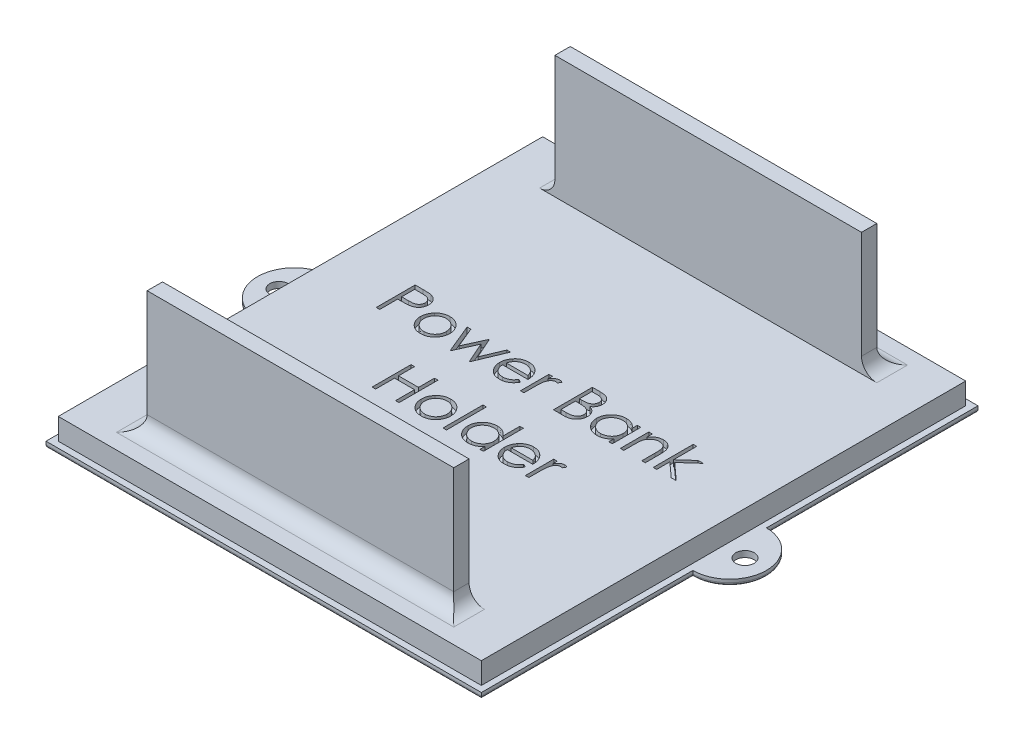
from build123d import *

# Parameters (mm, degrees)
SKETCH1_W            = 71
SKETCH1_H            = 81
BOSS_EXTRUDE1_DEPTH  = 4.5
BOSS_EXTRUDE3_DEPTH  = 4.5
SKETCH5_R            = 1.5
CUT_EXTRUDE2_DEPTH   = 4.5
SKETCH61_W           = 89
SKETCH61_H           = 99
SKETCH61_W_2         = 69
SKETCH61_H_2         = 79
CUT_EXTRUDE21_DEPTH  = 3.5
TEXT_2_W             = 0.569871795
TEXT_2_H             = 6.512820513
CUT_EXTRUDE1_DEPTH   = 1
SKETCH9_W            = 50
SKETCH9_H            = 2.5
TOP_TRACK_DEPTH      = 20
FILLET1_R            = 2.5
FILLET1_OF_MIRROR4_R = 2.5
FILLET2_R            = 0.5


with BuildPart() as part:
    # Sketch1 → Boss-Extrude1 (new body)
    with BuildSketch(Plane(origin=(0, 0, 0), x_dir=(1, 0, 0), z_dir=(0, 1, 0))):
        Rectangle(SKETCH1_W, SKETCH1_H)
    extrude(amount=BOSS_EXTRUDE1_DEPTH)

    # Sketch4 → Boss-Extrude3 (add)
    with BuildSketch(Plane(origin=(0, 4.5, 0), x_dir=(1, 0, 0), z_dir=(0, 1, 0))):
        with BuildLine():
            Line((-35.5, 6), (-35.5, -6))
            ThreePointArc((-35.5, -6), (-41.5, 0), (-35.5, 6))
        make_face()
    boss_extrude3 = extrude(amount=-BOSS_EXTRUDE3_DEPTH)

    # Sketch5 → Cut-Extrude2 (cut)
    with BuildSketch(Plane(origin=(0, 4.5, 0), x_dir=(1, 0, 0), z_dir=(0, 1, 0))):
        with Locations(Location((-38, 0, 0), (0, 0, 270))):
            Circle(SKETCH5_R)
    cut_extrude2 = extrude(amount=-CUT_EXTRUDE2_DEPTH, mode=Mode.SUBTRACT)

    # Mirror3: Boss-Extrude3, Cut-Extrude2 across plane
    add(boss_extrude3.mirror(Plane(origin=(0, 0, 0), x_dir=(0, 0, 1), z_dir=(1, 0, 0))))
    add(cut_extrude2.mirror(Plane(origin=(0, 0, 0), x_dir=(0, 0, 1), z_dir=(1, 0, 0))), mode=Mode.SUBTRACT)

    # Sketch61 → Cut-Extrude21 (cut)
    with BuildSketch(Plane(origin=(0, 4.5, 0), x_dir=(1, 0, 0), z_dir=(0, 1, 0))):
        Rectangle(SKETCH61_W, SKETCH61_H)
        Rectangle(SKETCH61_W_2, SKETCH61_H_2, mode=Mode.SUBTRACT)
    extrude(amount=-CUT_EXTRUDE21_DEPTH, mode=Mode.SUBTRACT)

    # text 2 → Cut-Extrude1 (cut)
    # profile 1 of 15: a face of its own
    with BuildSketch(Plane(origin=(0, 4.5, 0), x_dir=(1, 0, 0), z_dir=(0, 1, 0))):
        with BuildLine():
            Line((-23.961048132, 8.167718703), (-22.715725616, 8.167718703))
            add(Edge.make_bspline(
                [(-22.715725616, 8.167718703), (-22.630071544, 8.167624548), (-22.465954537, 8.167444144), (-22.230614364, 8.161974533), (-22.016873851, 8.154668963), (-21.825193874, 8.144541814), (-21.654984668, 8.132573715), (-21.507016424, 8.115787872), (-21.380126086, 8.098261336), (-21.304095814, 8.080442498), (-21.26942153, 8.072316058)],
                knots=[0, 0, 0, 0, 1.415646017, 2.712440637, 3.8905458, 4.950247383, 5.884950622, 6.709939814, 7.411656543, 8, 8, 8, 8], degree=3))
            add(Edge.make_bspline(
                [(-21.26942153, 8.072316058), (-21.225527547, 8.06030195), (-21.138773888, 8.036556829), (-21.01376771, 7.988997645), (-20.894834305, 7.932605717), (-20.78156562, 7.868336569), (-20.675353555, 7.793432759), (-20.574613452, 7.710930624), (-20.480234345, 7.61892535), (-20.392746963, 7.518448865), (-20.312401687, 7.411187913), (-20.243223548, 7.295541295), (-20.185298437, 7.173455645), (-20.135617358, 7.04501588), (-20.099860591, 6.909143436), (-20.072924073, 6.766782401), (-20.05582692, 6.617948034), (-20.054189415, 6.516239418), (-20.053355825, 6.464463494)],
                knots=[0, 0, 0, 0, 0.999701418, 1.975846123, 2.934577507, 3.890451536, 4.834027766, 5.787354733, 6.749476667, 7.726910423, 8.712836071, 9.690891519, 10.682875813, 11.679750201, 12.712814741, 13.765529915, 14.8625177, 16, 16, 16, 16], degree=3))
            add(Edge.make_bspline(
                [(-20.053355825, 6.464463494), (-20.054120409, 6.412252385), (-20.055616371, 6.310097823), (-20.07357106, 6.16065005), (-20.097755837, 6.0178324), (-20.134943346, 5.88196154), (-20.183649067, 5.753844356), (-20.240784649, 5.631522978), (-20.309697625, 5.51707843), (-20.388881816, 5.410095231), (-20.47696828, 5.310472962), (-20.573584325, 5.218933549), (-20.678339899, 5.136012821), (-20.790902082, 5.061524883), (-20.912368236, 4.997197062), (-21.040896143, 4.939580237), (-21.177602965, 4.891191313), (-21.272204383, 4.865736773), (-21.32030294, 4.852794825)],
                knots=[0, 0, 0, 0, 1.121902311, 2.195077645, 3.232258892, 4.234102512, 5.217864754, 6.176164875, 7.132989551, 8.084763148, 9.034132444, 9.988522005, 10.94243251, 11.903244335, 12.886203696, 13.894208494, 14.929344452, 16, 16, 16, 16], degree=3))
            add(Edge.make_bspline(
                [(-21.32030294, 4.852794825), (-21.360085389, 4.844334845), (-21.447270938, 4.825794307), (-21.590858449, 4.805096106), (-21.758036506, 4.787429317), (-21.948576928, 4.774182967), (-22.162308684, 4.762843013), (-22.399347394, 4.753829471), (-22.660158363, 4.748876736), (-22.842079048, 4.748621298), (-22.937059751, 4.748487933)],
                knots=[0, 0, 0, 0, 0.601384939, 1.31797006, 2.144135048, 3.087295005, 4.142315834, 5.309527816, 6.595305764, 8, 8, 8, 8], degree=3))
            Line((-22.937059751, 4.748487933), (-23.391176337, 4.748487933))
            Line((-23.391176337, 4.748487933), (-23.391176337, 1.817718703))
            Line((-23.391176337, 1.817718703), (-23.961048132, 1.817718703))
            Line((-23.961048132, 1.817718703), (-23.961048132, 8.167718703))
        make_face()
        with BuildLine():
            Line((-23.391176337, 7.516436651), (-23.391176337, 5.399769985))
            Line((-23.391176337, 5.399769985), (-22.279417523, 5.385777597))
            add(Edge.make_bspline(
                [(-22.279417523, 5.385777597), (-22.225134229, 5.385749542), (-22.120341449, 5.385695381), (-21.968964302, 5.392925715), (-21.828521737, 5.401272396), (-21.699445151, 5.413493286), (-21.581676355, 5.430767567), (-21.475018982, 5.448206006), (-21.380300054, 5.473434307), (-21.269448645, 5.507403304), (-21.145926, 5.565338192), (-21.011546305, 5.649430135), (-20.897662527, 5.75661942), (-20.799113617, 5.877138486), (-20.720907239, 6.01121262), (-20.663655653, 6.154666263), (-20.630016696, 6.306028218), (-20.62550603, 6.409602413), (-20.623227619, 6.461919424)],
                knots=[0, 0, 0, 0, 1.160613943, 2.240541288, 3.23993089, 4.169200891, 5.011653406, 5.7853311, 6.478053781, 7.106038997, 8.262395093, 9.384106736, 10.481365981, 11.59014053, 12.70357646, 13.786202915, 14.881775077, 16, 16, 16, 16], degree=3))
            add(Edge.make_bspline(
                [(-20.623227619, 6.461919424), (-20.625518421, 6.512970727), (-20.630072251, 6.614454399), (-20.663919317, 6.763187293), (-20.720795929, 6.905129214), (-20.799638608, 7.03752324), (-20.895326086, 7.157608642), (-21.006540609, 7.261924858), (-21.133020383, 7.345784233), (-21.250673602, 7.399910329), (-21.355178611, 7.432958043), (-21.445950881, 7.456080825), (-21.548441105, 7.474542283), (-21.662682648, 7.489491095), (-21.787790046, 7.502288089), (-21.924838132, 7.510971219), (-22.073307742, 7.516053861), (-22.176378349, 7.516305965), (-22.229808148, 7.516436651)],
                knots=[0, 0, 0, 0, 1.120700087, 2.227813068, 3.331159281, 4.466773991, 5.599788987, 6.693661531, 7.80175334, 8.91857717, 9.525282508, 10.207424825, 10.974604443, 11.810962634, 12.737642355, 13.736264703, 14.826523623, 16, 16, 16, 16], degree=3))
            Line((-22.229808148, 7.516436651), (-23.391176337, 7.516436651))
        make_face(mode=Mode.SUBTRACT)
    # profile 2 of 15: a face of its own
    with BuildSketch(Plane(origin=(0, 4.5, 0), x_dir=(1, 0, 0), z_dir=(0, 1, 0))):
        with BuildLine():
            add(Edge.make_bspline(
                [(-16.672286113, 6.539513575), (-16.585216232, 6.537659572), (-16.414493475, 6.534024326), (-16.164470596, 6.49517146), (-15.925810135, 6.435758385), (-15.697598044, 6.353622836), (-15.482757051, 6.24352844), (-15.278157794, 6.112157298), (-15.08436122, 5.956523164), (-14.968205153, 5.836130668), (-14.909245248, 5.775020385)],
                knots=[0, 0, 0, 0, 1.054011418, 2.066658804, 3.057071809, 4.030435133, 4.997543892, 5.974964718, 6.972108034, 8, 8, 8, 8], degree=3))
            add(Edge.make_bspline(
                [(-14.909245248, 5.775020385), (-14.858477988, 5.716575011), (-14.757925955, 5.600815342), (-14.628992437, 5.413117301), (-14.517919035, 5.218734547), (-14.428904806, 5.015085826), (-14.35871912, 4.803948923), (-14.3088885, 4.584598131), (-14.279248632, 4.357517872), (-14.275251821, 4.203296623), (-14.273227619, 4.125190658)],
                knots=[0, 0, 0, 0, 1.025258237, 2.030674902, 3.01204498, 3.988269485, 4.97094183, 5.956517959, 6.965070386, 8, 8, 8, 8], degree=3))
            add(Edge.make_bspline(
                [(-14.273227619, 4.125190658), (-14.275008046, 4.046631982), (-14.278526251, 3.891396374), (-14.311806812, 3.662761239), (-14.363570354, 3.441064918), (-14.437650974, 3.227235574), (-14.532643544, 3.020619587), (-14.648559506, 2.822119404), (-14.786212297, 2.631343391), (-14.94224812, 2.449911485), (-15.114699381, 2.282695638), (-15.301781535, 2.136957206), (-15.49981814, 2.012095297), (-15.711442509, 1.911517801), (-15.934722092, 1.832215916), (-16.170138487, 1.776517314), (-16.417325972, 1.742841117), (-16.586103931, 1.738516634), (-16.672286113, 1.736308446)],
                knots=[0, 0, 0, 0, 0.998656419, 1.973391657, 2.932242238, 3.890759089, 4.846373663, 5.82037756, 6.809684879, 7.83454468, 8.860553229, 9.859544525, 10.845671541, 11.83227036, 12.833544569, 13.85385346, 14.904124723, 16, 16, 16, 16], degree=3))
            add(Edge.make_bspline(
                [(-16.672286113, 1.736308446), (-16.758890533, 1.738524045), (-16.928509664, 1.742863407), (-17.17656966, 1.776386478), (-17.412407968, 1.832190246), (-17.635979854, 1.911778411), (-17.848514077, 2.012098512), (-18.04769815, 2.13657972), (-18.234932282, 2.282738859), (-18.407420025, 2.449899773), (-18.563446066, 2.631346409), (-18.701101381, 2.822118621), (-18.817016687, 3.020619791), (-18.912009429, 3.227235519), (-18.986090004, 3.441064933), (-19.037853558, 3.662761235), (-19.071134115, 3.891396375), (-19.074652321, 4.046631982), (-19.076432748, 4.125190658)],
                knots=[0, 0, 0, 0, 1.099876186, 2.154163076, 3.173186993, 4.173200201, 5.163417411, 6.152872554, 7.150605724, 8.17532212, 9.198891216, 10.186952605, 11.159729845, 12.11414092, 13.071450619, 14.029093627, 15.002601286, 16, 16, 16, 16], degree=3))
            add(Edge.make_bspline(
                [(-19.076432748, 4.125190658), (-19.074394742, 4.202872105), (-19.07035984, 4.356668021), (-19.040749774, 4.583321403), (-18.991113536, 4.802300951), (-18.920843716, 5.012622886), (-18.831009013, 5.215379178), (-18.72149639, 5.410242228), (-18.591247671, 5.597091523), (-18.491095559, 5.712701583), (-18.440415119, 5.77120428)],
                knots=[0, 0, 0, 0, 1.031353054, 2.041901799, 3.029428768, 4.008703097, 4.981709435, 5.96992636, 6.972712378, 8, 8, 8, 8], degree=3))
            add(Edge.make_bspline(
                [(-18.440415119, 5.77120428), (-18.381544104, 5.832844527), (-18.265763894, 5.954070918), (-18.071002631, 6.109251355), (-17.866906698, 6.243356232), (-17.649691475, 6.35126308), (-17.421666862, 6.436241533), (-17.181783379, 6.495324682), (-16.930912086, 6.53388434), (-16.759353917, 6.537618463), (-16.672286113, 6.539513575)],
                knots=[0, 0, 0, 0, 1.027980169, 2.021703884, 2.998553061, 3.971491411, 4.943284454, 5.930300938, 6.949603206, 8, 8, 8, 8], degree=3))
        make_face()
        with BuildLine():
            add(Edge.make_bspline(
                [(-16.674830184, 5.96964178), (-16.736402707, 5.967891735), (-16.857958269, 5.964436822), (-17.036882373, 5.938158881), (-17.209130938, 5.896525552), (-17.375030755, 5.837372478), (-17.534022368, 5.760993047), (-17.686257998, 5.667179308), (-17.832185424, 5.557173802), (-17.968950025, 5.431148669), (-18.094466506, 5.293482493), (-18.204190835, 5.14680047), (-18.297490671, 4.993481814), (-18.375214959, 4.833367088), (-18.433103714, 4.664833708), (-18.475146198, 4.489790277), (-18.501399349, 4.307880164), (-18.504821778, 4.184216603), (-18.506560953, 4.121374552)],
                knots=[0, 0, 0, 0, 1.021534396, 2.016698045, 2.994645724, 3.958388632, 4.93408049, 5.916473867, 6.921342795, 7.962252576, 8.998418191, 10.008913653, 10.997312074, 11.973003931, 12.956656626, 13.948281152, 14.957379055, 16, 16, 16, 16], degree=3))
            add(Edge.make_bspline(
                [(-18.506560953, 4.121374552), (-18.503645716, 4.040181589), (-18.497859515, 3.879028739), (-18.450805586, 3.641699987), (-18.372090478, 3.413858627), (-18.265796414, 3.196840327), (-18.13261656, 2.996049194), (-17.97570431, 2.817030929), (-17.796743711, 2.662479529), (-17.597868061, 2.53424428), (-17.383139512, 2.432354438), (-17.155888758, 2.360147725), (-16.918869213, 2.313209083), (-16.756888458, 2.308543693), (-16.674830184, 2.306180241)],
                knots=[0, 0, 0, 0, 1.016792936, 2.018143844, 3.017858371, 4.030088057, 5.03801393, 6.028138512, 7.003788237, 7.991172063, 8.984598303, 9.972568034, 10.972917682, 12, 12, 12, 12], degree=3))
            add(Edge.make_bspline(
                [(-16.674830184, 2.306180241), (-16.592776629, 2.308557464), (-16.43080519, 2.313250036), (-16.194114969, 2.359911323), (-15.967485335, 2.432670822), (-15.752979817, 2.534129688), (-15.554194694, 2.662966498), (-15.373947002, 2.81615821), (-15.218374522, 2.996523341), (-15.08532641, 3.197106286), (-14.977291606, 3.413522182), (-14.89894494, 3.641742039), (-14.851777891, 3.879018029), (-14.846006959, 4.040178001), (-14.843099414, 4.121374552)],
                knots=[0, 0, 0, 0, 1.02726834, 2.027799167, 3.010890988, 4.004497153, 4.992059811, 5.971914811, 6.958719428, 7.966827853, 8.981595046, 9.981490638, 10.983022906, 12, 12, 12, 12], degree=3))
            add(Edge.make_bspline(
                [(-14.843099414, 4.121374552), (-14.84483799, 4.184216978), (-14.848259241, 4.307881279), (-14.874520962, 4.489786016), (-14.916531727, 4.664849342), (-14.974537376, 4.833309405), (-15.051923944, 4.993896377), (-15.147022983, 5.14635031), (-15.256299272, 5.293990615), (-15.383330334, 5.430703649), (-15.519952176, 5.55722293), (-15.665938746, 5.667221965), (-15.817948635, 5.760580745), (-15.97647835, 5.838025782), (-16.142399437, 5.895987385), (-16.314406657, 5.938399273), (-16.492567355, 5.964325773), (-16.613687333, 5.967858444), (-16.674830184, 5.96964178)],
                knots=[0, 0, 0, 0, 1.042956736, 2.052379634, 3.044323526, 4.02829302, 5.004299113, 5.996692471, 7.007513377, 8.048758398, 9.090003419, 10.095195979, 11.07790575, 12.047570684, 13.018257071, 13.989683339, 14.985167495, 16, 16, 16, 16], degree=3))
        make_face(mode=Mode.SUBTRACT)
    # profile 3 of 15: a face of its own
    with BuildSketch(Plane(origin=(0, 4.5, 0), x_dir=(1, 0, 0), z_dir=(0, 1, 0))):
        Polygon((-13.784766081, 6.458103318), (-13.172917123, 6.458103318), (-11.790214799, 3.120282805), (-10.275220809, 6.458103318), (-10.178546129, 6.458103318), (-8.696625055, 3.120282805), (-7.301202379, 6.458103318), (-6.702073773, 6.458103318), (-8.641927539, 1.817718703), (-8.760226818, 1.817718703), (-10.243419927, 5.155539216), (-11.757141882, 1.817718703), (-11.862720809, 1.817718703), align=None)
    # profile 4 of 15: a face of its own
    with BuildSketch(Plane(origin=(0, 4.5, 0), x_dir=(1, 0, 0), z_dir=(0, 1, 0))):
        with BuildLine():
            Line((-2.160907908, 3.283103318), (-1.654637876, 3.01724795))
            add(Edge.make_bspline(
                [(-1.654637876, 3.01724795), (-1.694981413, 2.945686477), (-1.77347396, 2.806456191), (-1.908458174, 2.615172672), (-2.049958077, 2.443091816), (-2.20436099, 2.294810872), (-2.367047408, 2.165540502), (-2.53891951, 2.052441877), (-2.720872079, 1.956069705), (-2.912913723, 1.874875833), (-3.116657194, 1.812447179), (-3.332596231, 1.768352378), (-3.561144516, 1.741095877), (-3.717801156, 1.737929693), (-3.798017283, 1.736308446)],
                knots=[0, 0, 0, 0, 1.120438281, 2.179929193, 3.190490725, 4.156257408, 5.095198341, 6.022838206, 6.959905092, 7.901321166, 8.864066838, 9.862729781, 10.905609505, 12, 12, 12, 12], degree=3))
            add(Edge.make_bspline(
                [(-3.798017283, 1.736308446), (-3.887174871, 1.73838975), (-4.061095495, 1.742449771), (-4.314260465, 1.777451814), (-4.552620267, 1.834551664), (-4.7761615, 1.914317718), (-4.98433673, 2.018507292), (-5.17755971, 2.14543378), (-5.356846564, 2.294445157), (-5.516547629, 2.466832133), (-5.660318673, 2.651312255), (-5.787184089, 2.843546503), (-5.893242571, 3.04305121), (-5.979516593, 3.248556304), (-6.049193991, 3.458766511), (-6.097756439, 3.675594459), (-6.12575041, 3.898453304), (-6.13004019, 4.049215614), (-6.132201978, 4.125190658)],
                knots=[0, 0, 0, 0, 1.145258523, 2.234067595, 3.276747158, 4.290159414, 5.277019952, 6.260822364, 7.254936242, 8.264827045, 9.274100331, 10.257902744, 11.220704747, 12.172965371, 13.118907548, 14.062713208, 15.023725156, 16, 16, 16, 16], degree=3))
            add(Edge.make_bspline(
                [(-6.132201978, 4.125190658), (-6.130280393, 4.196482707), (-6.126472066, 4.337774135), (-6.102467637, 4.546898765), (-6.059925734, 4.750150386), (-6.001548689, 4.947697885), (-5.926162857, 5.139210499), (-5.833938688, 5.324804786), (-5.724732517, 5.504283254), (-5.640417808, 5.617500368), (-5.597947171, 5.6745296)],
                knots=[0, 0, 0, 0, 1.024358464, 2.0301432, 3.019427413, 4.004406732, 4.986367066, 5.972626655, 6.978780325, 8, 8, 8, 8], degree=3))
            add(Edge.make_bspline(
                [(-5.597947171, 5.6745296), (-5.540420375, 5.74323455), (-5.427189086, 5.878468052), (-5.235679698, 6.056156157), (-5.028306485, 6.205007006), (-4.807668249, 6.328391382), (-4.571200646, 6.422142141), (-4.322082361, 6.492005898), (-4.057476797, 6.531154575), (-3.87658304, 6.536684216), (-3.784024895, 6.539513575)],
                knots=[0, 0, 0, 0, 1.030682036, 2.02871468, 2.997146059, 3.962720338, 4.930598197, 5.918074684, 6.934738563, 8, 8, 8, 8], degree=3))
            add(Edge.make_bspline(
                [(-3.784024895, 6.539513575), (-3.688869954, 6.537056943), (-3.502197651, 6.532237592), (-3.229996517, 6.487558387), (-2.972439217, 6.416705895), (-2.729628816, 6.316641161), (-2.501540697, 6.187537403), (-2.289657436, 6.027622919), (-2.090355406, 5.841807246), (-1.974406984, 5.698908281), (-1.915405103, 5.62619226)],
                knots=[0, 0, 0, 0, 1.056321875, 2.072262726, 3.055038591, 4.01806755, 4.982017516, 5.957941055, 6.960871419, 8, 8, 8, 8], degree=3))
            add(Edge.make_bspline(
                [(-1.915405103, 5.62619226), (-1.875260515, 5.571394334), (-1.795238554, 5.462163233), (-1.695004529, 5.284052705), (-1.607996113, 5.097706341), (-1.538449169, 4.900111945), (-1.482134645, 4.693610707), (-1.44139156, 4.476726376), (-1.417498109, 4.249523536), (-1.412801473, 4.094716786), (-1.410407107, 4.015795626)],
                knots=[0, 0, 0, 0, 0.94817472, 1.890038105, 2.849395472, 3.817997239, 4.812318967, 5.836947057, 6.897266129, 8, 8, 8, 8], degree=3))
            Line((-1.410407107, 4.015795626), (-5.562330184, 4.015795626))
            add(Edge.make_bspline(
                [(-5.562330184, 4.015795626), (-5.559536898, 3.954653355), (-5.554044013, 3.834419545), (-5.528435111, 3.658486839), (-5.488069478, 3.490895204), (-5.431338465, 3.332901685), (-5.362637188, 3.182442739), (-5.278480245, 3.040634472), (-5.178078483, 2.908122799), (-5.066090428, 2.783722421), (-4.941436127, 2.672940754), (-4.810294571, 2.573786817), (-4.670787675, 2.490682377), (-4.524015437, 2.423227435), (-4.370215199, 2.370420261), (-4.209338502, 2.334374358), (-4.041701919, 2.310231464), (-3.927427802, 2.307546929), (-3.869251257, 2.306180241)],
                knots=[0, 0, 0, 0, 1.094153842, 2.151609401, 3.174256925, 4.172055639, 5.149267565, 6.128595816, 7.11444997, 8.118368179, 9.117203808, 10.09244225, 11.054858984, 12.015122123, 12.976791628, 13.957293641, 14.960065497, 16, 16, 16, 16], degree=3))
            add(Edge.make_bspline(
                [(-3.869251257, 2.306180241), (-3.812371318, 2.30728343), (-3.699510607, 2.309472367), (-3.531433623, 2.330757406), (-3.366080481, 2.365174906), (-3.204135554, 2.412146745), (-3.048885591, 2.469436177), (-2.905111521, 2.538565647), (-2.772885987, 2.61503733), (-2.649302348, 2.702503455), (-2.529430688, 2.809561166), (-2.410517892, 2.943157402), (-2.283015963, 3.10115906), (-2.203206274, 3.220077625), (-2.160907908, 3.283103318)],
                knots=[0, 0, 0, 0, 0.99110716, 1.966546729, 2.947904876, 3.932708344, 4.903319531, 5.828989031, 6.710028674, 7.56322171, 8.463672341, 9.504779593, 10.677557249, 12, 12, 12, 12], degree=3))
        make_face()
        with BuildLine():
            add(Edge.make_bspline(
                [(-1.980278902, 4.585667421), (-2.001137063, 4.661255777), (-2.04128231, 4.806739032), (-2.125168286, 5.008198933), (-2.219640938, 5.187246982), (-2.331440365, 5.342512888), (-2.458111482, 5.480404976), (-2.604424884, 5.600907266), (-2.768501434, 5.708707498), (-2.949493018, 5.799698462), (-3.141157399, 5.877150063), (-3.341828633, 5.929084201), (-3.546584906, 5.964661514), (-3.685077111, 5.967974596), (-3.754768084, 5.96964178)],
                knots=[0, 0, 0, 0, 1.154881502, 2.222775134, 3.210006277, 4.132804581, 5.035138423, 5.962687519, 6.919655026, 7.923214229, 8.944639381, 9.960483929, 10.97369054, 12, 12, 12, 12], degree=3))
            add(Edge.make_bspline(
                [(-3.754768084, 5.96964178), (-3.811644923, 5.968532033), (-3.924078475, 5.966338296), (-4.089724698, 5.945528205), (-4.248800723, 5.911129629), (-4.402480317, 5.864021779), (-4.548749606, 5.801231886), (-4.690617257, 5.727602318), (-4.824475976, 5.63771973), (-4.908189469, 5.569214379), (-4.950481225, 5.534605722)],
                knots=[0, 0, 0, 0, 1.04873581, 2.073130211, 3.073294108, 4.04793562, 5.032784715, 6.005352987, 6.992311501, 8, 8, 8, 8], degree=3))
            add(Edge.make_bspline(
                [(-4.950481225, 5.534605722), (-4.980767608, 5.507220321), (-5.042059866, 5.451798943), (-5.123957669, 5.356314525), (-5.202371955, 5.253350977), (-5.27373444, 5.138969108), (-5.339189489, 5.014471409), (-5.400439734, 4.880907985), (-5.455569367, 4.737265306), (-5.486586595, 4.637166738), (-5.502544527, 4.585667421)],
                knots=[0, 0, 0, 0, 0.879870761, 1.780643979, 2.707998968, 3.669668524, 4.684282772, 5.740141944, 6.837334558, 8, 8, 8, 8], degree=3))
            Line((-5.502544527, 4.585667421), (-1.980278902, 4.585667421))
        make_face(mode=Mode.SUBTRACT)
    # profile 5 of 15: a face of its own
    with BuildSketch(Plane(origin=(0, 4.5, 0), x_dir=(1, 0, 0), z_dir=(0, 1, 0))):
        with BuildLine():
            Line((-0.43348403, 6.458103318), (0.136387765, 6.458103318))
            Line((0.136387765, 6.458103318), (0.136387765, 5.775020385))
            add(Edge.make_bspline(
                [(0.136387765, 5.775020385), (0.178458799, 5.838621674), (0.258919324, 5.960258644), (0.392655639, 6.12113009), (0.529640254, 6.25432596), (0.670528951, 6.360468059), (0.816357789, 6.439957574), (0.963926259, 6.498183509), (1.11555604, 6.532613781), (1.217449817, 6.537210563), (1.268499143, 6.539513575)],
                knots=[0, 0, 0, 0, 1.2804753, 2.448899062, 3.506932113, 4.484331642, 5.4025378, 6.288909075, 7.142734305, 8, 8, 8, 8], degree=3))
            add(Edge.make_bspline(
                [(1.268499143, 6.539513575), (1.308098336, 6.537353619), (1.389576247, 6.532909371), (1.512916089, 6.501684017), (1.639994923, 6.451831033), (1.721896111, 6.404949487), (1.764592893, 6.380509167)],
                knots=[0, 0, 0, 0, 0.901110191, 1.854092781, 2.881294221, 4, 4, 4, 4], degree=3))
            Line((1.764592893, 6.380509167), (1.45167222, 5.886959488))
            add(Edge.make_bspline(
                [(1.45167222, 5.886959488), (1.424260139, 5.899188257), (1.372226761, 5.9224008), (1.296109191, 5.949872733), (1.225930194, 5.966048752), (1.181219739, 5.968499339), (1.160376147, 5.96964178)],
                knots=[0, 0, 0, 0, 1.180555205, 2.24091978, 3.179933427, 4, 4, 4, 4], degree=3))
            add(Edge.make_bspline(
                [(1.160376147, 5.96964178), (1.114645744, 5.966593712), (1.02136898, 5.960376537), (0.884418531, 5.911501843), (0.751527172, 5.832534622), (0.645987156, 5.744957033), (0.56426764, 5.660506029), (0.505956088, 5.586758213), (0.452465962, 5.504065553), (0.401357133, 5.413841698), (0.354791142, 5.31454612), (0.311330528, 5.207170862), (0.272035163, 5.091591557), (0.249628291, 5.011068984), (0.238150586, 4.969822068)],
                knots=[0, 0, 0, 0, 1.125678352, 2.296057538, 3.5422874, 4.923748041, 5.663163013, 6.437101912, 7.23742474, 8.08941207, 8.991984279, 9.93940061, 10.944477711, 12, 12, 12, 12], degree=3))
            add(Edge.make_bspline(
                [(0.238150586, 4.969822068), (0.229564672, 4.933033482), (0.210547526, 4.851549559), (0.192057164, 4.714845807), (0.173788181, 4.553331454), (0.160912888, 4.366556921), (0.14897844, 4.15498863), (0.142247291, 3.918304272), (0.136617308, 3.656260906), (0.136466601, 3.47306458), (0.136387765, 3.377233927)],
                knots=[0, 0, 0, 0, 0.566838948, 1.255505196, 2.06880316, 3.007127437, 4.065329342, 5.249902469, 6.561414163, 8, 8, 8, 8], degree=3))
            Line((0.136387765, 3.377233927), (0.136387765, 1.817718703))
            Line((0.136387765, 1.817718703), (-0.43348403, 1.817718703))
            Line((-0.43348403, 1.817718703), (-0.43348403, 6.458103318))
        make_face()
    # profile 6 of 15: a face of its own
    with BuildSketch(Plane(origin=(0, 4.5, 0), x_dir=(1, 0, 0), z_dir=(0, 1, 0))):
        with BuildLine():
            Line((4.939592893, 8.167718703), (6.178555233, 8.167718703))
            add(Edge.make_bspline(
                [(6.178555233, 8.167718703), (6.239204044, 8.167399841), (6.356756532, 8.166781808), (6.52769752, 8.157196699), (6.687806076, 8.144127184), (6.837128634, 8.12338973), (6.975596194, 8.098367506), (7.103626051, 8.068065639), (7.220811077, 8.03173164), (7.360715614, 7.973953387), (7.520228813, 7.888095639), (7.692945896, 7.761225242), (7.840636445, 7.606044916), (7.967974478, 7.430997813), (8.069213652, 7.238437198), (8.142455091, 7.03295267), (8.188824379, 6.817194653), (8.19359311, 6.669070601), (8.19600315, 6.594211091)],
                knots=[0, 0, 0, 0, 1.001505555, 1.941167018, 2.826882275, 3.653841531, 4.429895133, 5.150066043, 5.825578002, 6.45369114, 7.647487171, 8.808567382, 9.977351308, 11.170798116, 12.373658725, 13.556498008, 14.765093433, 16, 16, 16, 16], degree=3))
            add(Edge.make_bspline(
                [(8.19600315, 6.594211091), (8.194019739, 6.524084311), (8.19012215, 6.386278576), (8.152851715, 6.18472212), (8.094503074, 5.992859195), (8.013394979, 5.81139001), (7.907981358, 5.64441474), (7.783052694, 5.490586415), (7.632327638, 5.356418068), (7.519400617, 5.281410231), (7.462038807, 5.243309648)],
                knots=[0, 0, 0, 0, 1.044552857, 2.05264487, 3.044412934, 4.028983338, 5.005914585, 5.980388656, 6.974128949, 8, 8, 8, 8], degree=3))
            add(Edge.make_bspline(
                [(7.462038807, 5.243309648), (7.534175583, 5.215614579), (7.672191104, 5.16262705), (7.862121441, 5.068945566), (8.02576066, 4.967051451), (8.16436691, 4.855777951), (8.282908084, 4.73583768), (8.386418421, 4.605471973), (8.474740343, 4.462980227), (8.550419504, 4.309848098), (8.609472247, 4.14763922), (8.653697102, 3.977875098), (8.679038046, 3.801164476), (8.682644195, 3.680903859), (8.684464688, 3.620192661)],
                knots=[0, 0, 0, 0, 1.27268992, 2.434971085, 3.483601985, 4.442670788, 5.356604649, 6.2567628, 7.179492994, 8.113709626, 9.066344395, 10.018646069, 10.999752585, 12, 12, 12, 12], degree=3))
            add(Edge.make_bspline(
                [(8.684464688, 3.620192661), (8.68269241, 3.558204193), (8.679205404, 3.436240146), (8.653478884, 3.257070116), (8.609919504, 3.085846998), (8.549918996, 2.92146331), (8.471610225, 2.764237066), (8.37630949, 2.613990144), (8.262677939, 2.472232144), (8.135563876, 2.337387857), (7.991759698, 2.216143157), (7.836609686, 2.10816466), (7.668159934, 2.019362519), (7.48917703, 1.944766309), (7.2976532, 1.887784677), (7.094448469, 1.84792015), (6.879738093, 1.821059583), (6.732400402, 1.818851226), (6.65684049, 1.817718703)],
                knots=[0, 0, 0, 0, 0.978564426, 1.925352924, 2.850884081, 3.763762016, 4.682927383, 5.618979971, 6.567305752, 7.547517671, 8.540179244, 9.531824382, 10.526200242, 11.540722885, 12.589160233, 13.674978461, 14.80764778, 16, 16, 16, 16], degree=3))
            Line((6.65684049, 1.817718703), (4.939592893, 1.817718703))
            Line((4.939592893, 1.817718703), (4.939592893, 8.167718703))
        make_face()
        with BuildLine():
            Line((5.509464688, 7.516436651), (5.509464688, 5.481180241))
            Line((5.509464688, 5.481180241), (5.8923473, 5.481180241))
            add(Edge.make_bspline(
                [(5.8923473, 5.481180241), (5.948315829, 5.481905816), (6.056458432, 5.483307774), (6.213067388, 5.487323726), (6.358437063, 5.498568748), (6.492316532, 5.509810538), (6.614494966, 5.528088718), (6.724701686, 5.549845855), (6.824666283, 5.572856269), (6.939945173, 5.611989481), (7.070706094, 5.669824691), (7.210103297, 5.759580737), (7.332992978, 5.866486349), (7.436765018, 5.98984138), (7.521694401, 6.125670031), (7.58068357, 6.271805086), (7.620683642, 6.424604468), (7.624296849, 6.529503298), (7.626131355, 6.582762773)],
                knots=[0, 0, 0, 0, 1.156816544, 2.235205308, 3.236616184, 4.169592532, 5.011045266, 5.787822928, 6.49130361, 7.128639758, 8.301311294, 9.436451833, 10.541879658, 11.654887649, 12.756523258, 13.837046038, 14.901820046, 16, 16, 16, 16], degree=3))
            add(Edge.make_bspline(
                [(7.626131355, 6.582762773), (7.625176714, 6.618006673), (7.623304081, 6.687141431), (7.607967375, 6.787923831), (7.58190049, 6.882708924), (7.548419129, 6.972795667), (7.501631079, 7.055367167), (7.446543082, 7.133278394), (7.379984758, 7.203876094), (7.304225062, 7.269860756), (7.217123703, 7.328361542), (7.118732645, 7.379598355), (7.007720717, 7.420856621), (6.885958823, 7.456990212), (6.751572707, 7.482368974), (6.60611316, 7.503511548), (6.448388741, 7.514275238), (6.339268341, 7.51570011), (6.282862124, 7.516436651)],
                knots=[0, 0, 0, 0, 0.91205012, 1.789085906, 2.630437955, 3.453916878, 4.269457761, 5.079663411, 5.91843418, 6.774407191, 7.675494373, 8.627863946, 9.638891023, 10.736472738, 11.911756761, 13.175263542, 14.539845004, 16, 16, 16, 16], degree=3))
            Line((6.282862124, 7.516436651), (5.509464688, 7.516436651))
        make_face(mode=Mode.SUBTRACT)
        with BuildLine():
            Line((5.509464688, 4.82989819), (5.509464688, 2.469000754))
            Line((5.509464688, 2.469000754), (6.321023182, 2.469000754))
            add(Edge.make_bspline(
                [(6.321023182, 2.469000754), (6.379114662, 2.469696981), (6.491078331, 2.471038868), (6.65273342, 2.47541956), (6.802562765, 2.485384117), (6.939882669, 2.501070159), (7.066175918, 2.518085345), (7.179927465, 2.540965812), (7.282059402, 2.567180355), (7.400485646, 2.607700924), (7.533842011, 2.670650236), (7.677553136, 2.765563189), (7.805326418, 2.878635476), (7.913830245, 3.009501563), (8.00275381, 3.151798399), (8.067442993, 3.30264782), (8.10734069, 3.459557277), (8.112170626, 3.566539741), (8.114592893, 3.620192661)],
                knots=[0, 0, 0, 0, 1.160039823, 2.235823828, 3.228722157, 4.157150951, 4.99529583, 5.772374946, 6.472645482, 7.099169577, 8.269452708, 9.405989375, 10.527446681, 11.663510218, 12.788923519, 13.866172445, 14.929861265, 16, 16, 16, 16], degree=3))
            add(Edge.make_bspline(
                [(8.114592893, 3.620192661), (8.114091961, 3.653744865), (8.113098177, 3.720308072), (8.098111061, 3.818126772), (8.076314469, 3.912879428), (8.04813601, 4.004823329), (8.007097834, 4.092296168), (7.959188817, 4.177027955), (7.903015988, 4.259130696), (7.815487287, 4.36293007), (7.688175258, 4.482522365), (7.50727868, 4.599611834), (7.301588939, 4.694041426), (7.152404774, 4.734136191), (7.075340089, 4.75484811)],
                knots=[0, 0, 0, 0, 0.723448775, 1.435228256, 2.130040452, 2.821711965, 3.505591119, 4.210454504, 4.921174351, 5.648778258, 7.137944449, 8.670945889, 10.280296675, 12, 12, 12, 12], degree=3))
            add(Edge.make_bspline(
                [(7.075340089, 4.75484811), (7.044444444, 4.761116619), (6.977456312, 4.774708041), (6.868222559, 4.789054874), (6.743516054, 4.801836626), (6.603048834, 4.811291154), (6.446643179, 4.821063883), (6.273965055, 4.824864488), (6.085719641, 4.829398859), (5.955104909, 4.829727489), (5.887259159, 4.82989819)],
                knots=[0, 0, 0, 0, 0.634451884, 1.375622551, 2.216452059, 3.157844607, 4.20941857, 5.370758133, 6.634282058, 8, 8, 8, 8], degree=3))
            Line((5.887259159, 4.82989819), (5.509464688, 4.82989819))
        make_face(mode=Mode.SUBTRACT)
    # profile 7 of 15: a face of its own
    with BuildSketch(Plane(origin=(0, 4.5, 0), x_dir=(1, 0, 0), z_dir=(0, 1, 0))):
        with BuildLine():
            Line((14.54600315, 6.458103318), (14.54600315, 1.817718703))
            Line((14.54600315, 1.817718703), (13.976131355, 1.817718703))
            Line((13.976131355, 1.817718703), (13.976131355, 2.62037295))
            add(Edge.make_bspline(
                [(13.976131355, 2.62037295), (13.911871549, 2.547729686), (13.78646773, 2.405965444), (13.577024559, 2.220759217), (13.355013722, 2.067672834), (13.121512753, 1.944029415), (12.876732512, 1.851152399), (12.621215611, 1.78513751), (12.35485782, 1.742694409), (12.172971405, 1.738456198), (12.080798823, 1.736308446)],
                knots=[0, 0, 0, 0, 1.074387032, 2.096679803, 3.090159297, 4.057316773, 5.018401886, 5.985159533, 6.978961417, 8, 8, 8, 8], degree=3))
            add(Edge.make_bspline(
                [(12.080798823, 1.736308446), (11.998851249, 1.738533436), (11.837247006, 1.742921214), (11.599522823, 1.776961394), (11.370755457, 1.83162695), (11.150728732, 1.907647135), (10.940866411, 2.008486626), (10.739371664, 2.129211462), (10.547288351, 2.272976968), (10.367544274, 2.437329533), (10.202023359, 2.615846153), (10.056769335, 2.806247359), (9.935660176, 3.007709825), (9.834386601, 3.217682833), (9.756378948, 3.437782758), (9.701998211, 3.667248477), (9.667997687, 3.905808676), (9.663611722, 4.068258954), (9.661387765, 4.150631363)],
                knots=[0, 0, 0, 0, 1.033919861, 2.038935746, 3.024066025, 3.998881131, 4.97069526, 5.957263378, 6.95902576, 7.993208707, 9.027059324, 10.027763471, 11.009749337, 11.988697705, 12.965288445, 13.950418724, 14.960734635, 16, 16, 16, 16], degree=3))
            add(Edge.make_bspline(
                [(9.661387765, 4.150631363), (9.663661013, 4.231301225), (9.668155102, 4.390781191), (9.701634515, 4.625329686), (9.757933631, 4.851241387), (9.836941869, 5.067788984), (9.93825513, 5.275234504), (10.061496088, 5.473724664), (10.206673643, 5.663806285), (10.374045867, 5.841009796), (10.555356093, 6.004695768), (10.749319076, 6.146952179), (10.951109886, 6.26980989), (11.163858491, 6.367152626), (11.384415953, 6.445909144), (11.614745776, 6.500397529), (11.85388964, 6.532505526), (12.016250961, 6.537155113), (12.098607316, 6.539513575)],
                knots=[0, 0, 0, 0, 1.020392517, 2.01726096, 2.990465484, 3.961182959, 4.928053699, 5.906110375, 6.912531644, 7.948652711, 8.985773172, 9.998621852, 10.987621588, 11.969261332, 12.953316658, 13.946091881, 14.958173133, 16, 16, 16, 16], degree=3))
            add(Edge.make_bspline(
                [(12.098607316, 6.539513575), (12.193312775, 6.536905082), (12.37902571, 6.531789953), (12.650675098, 6.489221862), (12.907658651, 6.417306357), (13.151960118, 6.31948461), (13.38270222, 6.189493345), (13.597700491, 6.025518273), (13.799205011, 5.828593548), (13.916009254, 5.677335741), (13.976131355, 5.59947952)],
                knots=[0, 0, 0, 0, 1.038897134, 2.037228247, 3.008116434, 3.962042015, 4.918381754, 5.904844433, 6.921570401, 8, 8, 8, 8], degree=3))
            Line((13.976131355, 5.59947952), (13.976131355, 6.458103318))
            Line((13.976131355, 6.458103318), (14.54600315, 6.458103318))
        make_face()
        with BuildLine():
            add(Edge.make_bspline(
                [(12.106239528, 5.96964178), (12.022937801, 5.966677894), (11.858513441, 5.960827655), (11.617133608, 5.915155743), (11.3861507, 5.839165121), (11.166719965, 5.735239386), (10.962307629, 5.604558679), (10.779620541, 5.446495597), (10.617164497, 5.265362729), (10.480533789, 5.061977472), (10.369153887, 4.843940078), (10.290836558, 4.616021454), (10.239185209, 4.382332424), (10.233908322, 4.223831551), (10.23125956, 4.144271187)],
                knots=[0, 0, 0, 0, 1.031046209, 2.035121221, 3.029706178, 4.034933723, 5.034054252, 6.02443088, 7.017295772, 8.038157696, 9.050218397, 10.03989886, 11.016116709, 12, 12, 12, 12], degree=3))
            add(Edge.make_bspline(
                [(10.23125956, 4.144271187), (10.234643009, 4.065186278), (10.241396646, 3.907326447), (10.289930049, 3.673318829), (10.371354962, 3.445346495), (10.482465561, 3.225344407), (10.621597009, 3.021084682), (10.782866422, 2.836499031), (10.967833361, 2.677767921), (11.172716123, 2.544894037), (11.391533441, 2.437556321), (11.621646431, 2.362870089), (11.858729375, 2.314650402), (12.019932895, 2.309017994), (12.101151387, 2.306180241)],
                knots=[0, 0, 0, 0, 0.979072187, 1.954306742, 2.945804271, 3.96968567, 4.997920485, 5.998718438, 6.996577872, 8.005894225, 9.015743152, 10.005417472, 10.995077863, 12, 12, 12, 12], degree=3))
            add(Edge.make_bspline(
                [(12.101151387, 2.306180241), (12.183604328, 2.30919189), (12.347595049, 2.315181761), (12.58969099, 2.361049199), (12.824631851, 2.436829733), (13.049217252, 2.541875292), (13.258433661, 2.672063638), (13.446208382, 2.824476503), (13.604987353, 3.001737994), (13.739593945, 3.196549559), (13.845140772, 3.410112752), (13.922023051, 3.637504784), (13.967477994, 3.87873357), (13.973207018, 4.043586695), (13.976131355, 4.127734728)],
                knots=[0, 0, 0, 0, 1.01762866, 2.023962475, 3.030623092, 4.058876274, 5.077231937, 6.066672613, 7.034107872, 8.005628644, 8.981990164, 9.965428785, 10.961468474, 12, 12, 12, 12], degree=3))
            add(Edge.make_bspline(
                [(13.976131355, 4.127734728), (13.974390264, 4.191847649), (13.970963246, 4.318042167), (13.94478207, 4.503330663), (13.903135275, 4.680647566), (13.844450081, 4.850179302), (13.767358751, 5.010988544), (13.674380661, 5.164229938), (13.563880774, 5.309106478), (13.437637882, 5.443623193), (13.299452443, 5.566316917), (13.15323092, 5.675834897), (12.997240907, 5.765803099), (12.834105712, 5.840263691), (12.663542291, 5.899516721), (12.484162737, 5.939045822), (12.297873718, 5.966188119), (12.170790161, 5.968478438), (12.106239528, 5.96964178)],
                knots=[0, 0, 0, 0, 1.050140795, 2.067009409, 3.05949893, 4.030605086, 5.00011959, 5.97591094, 6.962425594, 7.979863591, 8.993523472, 9.986985069, 10.967611495, 11.937549037, 12.921786183, 13.919465291, 14.943216303, 16, 16, 16, 16], degree=3))
        make_face(mode=Mode.SUBTRACT)
    # profile 8 of 15: a face of its own
    with BuildSketch(Plane(origin=(0, 4.5, 0), x_dir=(1, 0, 0), z_dir=(0, 1, 0))):
        with BuildLine():
            Line((15.848567252, 6.458103318), (16.418439047, 6.458103318))
            Line((16.418439047, 6.458103318), (16.418439047, 5.621104119))
            add(Edge.make_bspline(
                [(16.418439047, 5.621104119), (16.4792859, 5.697018774), (16.597361339, 5.844333809), (16.794001487, 6.037955423), (17.001816849, 6.197513188), (17.219534769, 6.3247015), (17.447450802, 6.420580379), (17.684175663, 6.489824282), (17.93112663, 6.5313439), (18.099064965, 6.536769032), (18.184023983, 6.539513575)],
                knots=[0, 0, 0, 0, 1.12780773, 2.188550248, 3.19190651, 4.159438251, 5.104880172, 6.052711206, 7.014878035, 8, 8, 8, 8], degree=3))
            add(Edge.make_bspline(
                [(18.184023983, 6.539513575), (18.269895276, 6.536347291), (18.437966111, 6.530150111), (18.682673451, 6.481134115), (18.911225179, 6.397413438), (19.122806373, 6.282728681), (19.313537175, 6.14011408), (19.481040834, 5.973965818), (19.619585583, 5.782856067), (19.712472227, 5.605558341), (19.773660188, 5.4482801), (19.812181714, 5.313575282), (19.844895066, 5.163500922), (19.873255524, 4.998510525), (19.892445427, 4.817448094), (19.907580727, 4.621055853), (19.918427787, 4.409397416), (19.918858148, 4.26300882), (19.919080073, 4.187520385)],
                knots=[0, 0, 0, 0, 1.235846778, 2.418850247, 3.575807741, 4.728682307, 5.871620074, 6.994088408, 8.11269785, 9.256955736, 9.865816715, 10.540099792, 11.271859618, 12.076849838, 12.949306005, 13.892391288, 14.913166135, 16, 16, 16, 16], degree=3))
            Line((19.919080073, 4.187520385), (19.919080073, 1.817718703))
            Line((19.919080073, 1.817718703), (19.349208278, 1.817718703))
            Line((19.349208278, 1.817718703), (19.349208278, 4.000531203))
            add(Edge.make_bspline(
                [(19.349208278, 4.000531203), (19.348857743, 4.063709067), (19.34818723, 4.18455757), (19.346072414, 4.357584226), (19.340974622, 4.51449559), (19.333811255, 4.654916528), (19.323326442, 4.778712202), (19.312399668, 4.886134747), (19.299037496, 4.977047774), (19.287130496, 5.031775852), (19.281790409, 5.056320466)],
                knots=[0, 0, 0, 0, 1.430800155, 2.736877192, 3.918605307, 4.986035426, 5.920637409, 6.731861385, 7.431261377, 8, 8, 8, 8], degree=3))
            add(Edge.make_bspline(
                [(19.281790409, 5.056320466), (19.262512659, 5.128367901), (19.225408955, 5.267036923), (19.133725871, 5.45513182), (19.017948715, 5.615148533), (18.876619759, 5.746097728), (18.711104151, 5.848007674), (18.521861192, 5.918717563), (18.310717087, 5.96294308), (18.162209849, 5.967346591), (18.084805233, 5.96964178)],
                knots=[0, 0, 0, 0, 1.084156227, 2.086665306, 3.027808233, 3.945421172, 4.874247719, 5.839848303, 6.874090471, 8, 8, 8, 8], degree=3))
            add(Edge.make_bspline(
                [(18.084805233, 5.96964178), (18.038962436, 5.968778171), (17.948240724, 5.967069112), (17.813711489, 5.949921757), (17.683220489, 5.921875702), (17.55545811, 5.884014031), (17.432979685, 5.832012486), (17.311850185, 5.772994914), (17.19663077, 5.699428872), (17.084864607, 5.617440173), (16.980882798, 5.526582183), (16.884129956, 5.430707143), (16.797882405, 5.328607119), (16.719743522, 5.221927215), (16.65229153, 5.109202308), (16.593412356, 4.991519924), (16.543454739, 4.868725168), (16.518630425, 4.783498986), (16.50620948, 4.740855722)],
                knots=[0, 0, 0, 0, 1.023777757, 2.026029729, 3.023749952, 4.003683103, 4.997618607, 5.993177895, 7.010360494, 8.046726602, 9.087585522, 10.09234134, 11.086953743, 12.070360549, 13.043493632, 14.017870808, 15.008233677, 16, 16, 16, 16], degree=3))
            add(Edge.make_bspline(
                [(16.50620948, 4.740855722), (16.499061832, 4.709549854), (16.483501776, 4.641398616), (16.466695721, 4.529558026), (16.451441977, 4.400181357), (16.438674923, 4.253419582), (16.430863668, 4.088758866), (16.422346691, 3.906902417), (16.419245966, 3.707125088), (16.418715552, 3.568038874), (16.418439047, 3.495533206)],
                knots=[0, 0, 0, 0, 0.615963638, 1.340920617, 2.168419149, 3.115676021, 4.16674242, 5.331190069, 6.6087489, 8, 8, 8, 8], degree=3))
            Line((16.418439047, 3.495533206), (16.418439047, 1.817718703))
            Line((16.418439047, 1.817718703), (15.848567252, 1.817718703))
            Line((15.848567252, 1.817718703), (15.848567252, 6.458103318))
        make_face()
    # profile 9 of 15: a face of its own
    with BuildSketch(Plane(origin=(0, 4.5, 0), x_dir=(1, 0, 0), z_dir=(0, 1, 0))):
        Polygon((21.221644175, 8.330539216), (21.79151597, 8.330539216), (21.79151597, 4.565314857), (23.903094496, 6.458103318), (24.722285201, 6.458103318), (22.272345297, 4.260026395), (24.96651597, 1.817718703), (24.1485973, 1.817718703), (21.79151597, 3.956009969), (21.79151597, 1.817718703), (21.221644175, 1.817718703), align=None)
    # profile 10 of 15: a face of its own
    with BuildSketch(Plane(origin=(0, 4.5, 0), x_dir=(1, 0, 0), z_dir=(0, 1, 0))):
        Polygon((-13.052073773, -3.415614631), (-12.482201978, -3.415614631), (-12.482201978, -6.020742836), (-9.225791722, -6.020742836), (-9.225791722, -3.415614631), (-8.655919927, -3.415614631), (-8.655919927, -9.765614631), (-9.225791722, -9.765614631), (-9.225791722, -6.672024887), (-12.482201978, -6.672024887), (-12.482201978, -9.765614631), (-13.052073773, -9.765614631), align=None)
    # profile 11 of 15: a face of its own
    with BuildSketch(Plane(origin=(0, 4.5, 0), x_dir=(1, 0, 0), z_dir=(0, 1, 0))):
        with BuildLine():
            add(Edge.make_bspline(
                [(-4.94920919, -5.043819759), (-4.862139309, -5.045673761), (-4.691416552, -5.049309007), (-4.441393673, -5.088161873), (-4.202733212, -5.147574949), (-3.974521121, -5.229710497), (-3.759680128, -5.339804893), (-3.555080871, -5.471176036), (-3.361284297, -5.62681017), (-3.24512823, -5.747202665), (-3.186168325, -5.808312948)],
                knots=[0, 0, 0, 0, 1.054011418, 2.066658804, 3.057071809, 4.030435133, 4.997543892, 5.974964718, 6.972108034, 8, 8, 8, 8], degree=3))
            add(Edge.make_bspline(
                [(-3.186168325, -5.808312948), (-3.135401065, -5.866758322), (-3.034849032, -5.982517992), (-2.905915514, -6.170216032), (-2.794842112, -6.364598786), (-2.705827883, -6.568247507), (-2.635642197, -6.779384411), (-2.585811577, -6.998735202), (-2.556171709, -7.225815461), (-2.552174897, -7.38003671), (-2.550150696, -7.458142675)],
                knots=[0, 0, 0, 0, 1.025258237, 2.030674902, 3.01204498, 3.988269485, 4.97094183, 5.956517959, 6.965070386, 8, 8, 8, 8], degree=3))
            add(Edge.make_bspline(
                [(-2.550150696, -7.458142675), (-2.551931123, -7.536701352), (-2.555449328, -7.691936959), (-2.588729889, -7.920572094), (-2.640493431, -8.142268415), (-2.714574051, -8.35609776), (-2.809566621, -8.562713747), (-2.925482583, -8.761213929), (-3.063135374, -8.951989942), (-3.219171197, -9.133421849), (-3.391622458, -9.300637696), (-3.578704612, -9.446376127), (-3.776741216, -9.571238036), (-3.988365586, -9.671815533), (-4.211645169, -9.751117418), (-4.447061564, -9.806816019), (-4.694249049, -9.840492217), (-4.863027008, -9.8448167), (-4.94920919, -9.847024887)],
                knots=[0, 0, 0, 0, 0.998656419, 1.973391657, 2.932242238, 3.890759089, 4.846373663, 5.82037756, 6.809684879, 7.83454468, 8.860553229, 9.859544525, 10.845671541, 11.83227036, 12.833544569, 13.85385346, 14.904124723, 16, 16, 16, 16], degree=3))
            add(Edge.make_bspline(
                [(-4.94920919, -9.847024887), (-5.03581361, -9.844809288), (-5.205432741, -9.840469926), (-5.453492737, -9.806946856), (-5.689331045, -9.751143087), (-5.912902931, -9.671554922), (-6.125437154, -9.571234821), (-6.324621227, -9.446753613), (-6.511855359, -9.300594474), (-6.684343102, -9.13343356), (-6.840369143, -8.951986925), (-6.978024458, -8.761214712), (-7.093939764, -8.562713543), (-7.188932506, -8.356097814), (-7.263013081, -8.142268401), (-7.314776634, -7.920572098), (-7.348057192, -7.691936958), (-7.351575398, -7.536701351), (-7.353355825, -7.458142675)],
                knots=[0, 0, 0, 0, 1.099876186, 2.154163076, 3.173186993, 4.173200201, 5.163417411, 6.152872554, 7.150605724, 8.17532212, 9.198891216, 10.186952605, 11.159729845, 12.11414092, 13.071450619, 14.029093627, 15.002601286, 16, 16, 16, 16], degree=3))
            add(Edge.make_bspline(
                [(-7.353355825, -7.458142675), (-7.351317819, -7.380461228), (-7.347282917, -7.226665312), (-7.317672851, -7.000011931), (-7.268036613, -6.781032382), (-7.197766793, -6.570710447), (-7.10793209, -6.367954156), (-6.998419467, -6.173091105), (-6.868170748, -5.98624181), (-6.768018636, -5.870631751), (-6.717338196, -5.812129054)],
                knots=[0, 0, 0, 0, 1.031353054, 2.041901799, 3.029428768, 4.008703097, 4.981709435, 5.96992636, 6.972712378, 8, 8, 8, 8], degree=3))
            add(Edge.make_bspline(
                [(-6.717338196, -5.812129054), (-6.658467181, -5.750488807), (-6.542686971, -5.629262415), (-6.347925708, -5.474081978), (-6.143829775, -5.339977102), (-5.926614552, -5.232070254), (-5.698589939, -5.1470918), (-5.458706456, -5.088008651), (-5.207835163, -5.049448993), (-5.036276994, -5.04571487), (-4.94920919, -5.043819759)],
                knots=[0, 0, 0, 0, 1.027980169, 2.021703884, 2.998553061, 3.971491411, 4.943284454, 5.930300938, 6.949603206, 8, 8, 8, 8], degree=3))
        make_face()
        with BuildLine():
            add(Edge.make_bspline(
                [(-4.95175326, -5.613691554), (-5.013325784, -5.615441599), (-5.134881346, -5.618896511), (-5.31380545, -5.645174453), (-5.486054015, -5.686807781), (-5.651953832, -5.745960855), (-5.810945445, -5.822340286), (-5.963181075, -5.916154025), (-6.109108501, -6.026159532), (-6.245873102, -6.152184665), (-6.371389583, -6.28985084), (-6.481113912, -6.436532863), (-6.574413747, -6.58985152), (-6.652138036, -6.749966246), (-6.710026791, -6.918499625), (-6.752069275, -7.093543056), (-6.778322426, -7.275453169), (-6.781744855, -7.399116731), (-6.78348403, -7.461958781)],
                knots=[0, 0, 0, 0, 1.021534396, 2.016698045, 2.994645724, 3.958388632, 4.93408049, 5.916473867, 6.921342795, 7.962252576, 8.998418191, 10.008913653, 10.997312074, 11.973003931, 12.956656626, 13.948281152, 14.957379055, 16, 16, 16, 16], degree=3))
            add(Edge.make_bspline(
                [(-6.78348403, -7.461958781), (-6.780568793, -7.543151745), (-6.774782592, -7.704304595), (-6.727728663, -7.941633346), (-6.649013555, -8.169474706), (-6.542719491, -8.386493007), (-6.409539637, -8.58728414), (-6.252627387, -8.766302404), (-6.073666788, -8.920853805), (-5.874791138, -9.049089053), (-5.660062589, -9.150978896), (-5.432811835, -9.223185609), (-5.19579229, -9.270124251), (-5.033811535, -9.27478964), (-4.95175326, -9.277153092)],
                knots=[0, 0, 0, 0, 1.016792936, 2.018143844, 3.017858371, 4.030088057, 5.03801393, 6.028138512, 7.003788237, 7.991172063, 8.984598303, 9.972568034, 10.972917682, 12, 12, 12, 12], degree=3))
            add(Edge.make_bspline(
                [(-4.95175326, -9.277153092), (-4.869699705, -9.274775869), (-4.707728267, -9.270083298), (-4.471038046, -9.22342201), (-4.244408412, -9.150662512), (-4.029902894, -9.049203645), (-3.831117771, -8.920366836), (-3.650870079, -8.767175123), (-3.495297599, -8.586809993), (-3.362249487, -8.386227047), (-3.254214683, -8.169811152), (-3.175868017, -7.941591295), (-3.128700968, -7.704315304), (-3.122930036, -7.543155333), (-3.120022491, -7.461958781)],
                knots=[0, 0, 0, 0, 1.02726834, 2.027799167, 3.010890988, 4.004497153, 4.992059811, 5.971914811, 6.958719428, 7.966827853, 8.981595046, 9.981490638, 10.983022906, 12, 12, 12, 12], degree=3))
            add(Edge.make_bspline(
                [(-3.120022491, -7.461958781), (-3.121761067, -7.399116355), (-3.125182318, -7.275452054), (-3.151444039, -7.093547317), (-3.193454804, -6.918483992), (-3.251460453, -6.750023929), (-3.328847021, -6.589436956), (-3.423946059, -6.436983023), (-3.533222348, -6.289342718), (-3.660253411, -6.152629684), (-3.796875253, -6.026110404), (-3.942861823, -5.916111368), (-4.094871712, -5.822752588), (-4.253401427, -5.745307552), (-4.419322514, -5.687345948), (-4.591329734, -5.64493406), (-4.769490432, -5.61900756), (-4.89061041, -5.615474889), (-4.95175326, -5.613691554)],
                knots=[0, 0, 0, 0, 1.042956736, 2.052379634, 3.044323526, 4.02829302, 5.004299113, 5.996692471, 7.007513377, 8.048758398, 9.090003419, 10.095195979, 11.07790575, 12.047570684, 13.018257071, 13.989683339, 14.985167495, 16, 16, 16, 16], degree=3))
        make_face(mode=Mode.SUBTRACT)
    # profile 12 of 15: a face of its own
    with BuildSketch(Plane(origin=(0, 4.5, 0), x_dir=(1, 0, 0), z_dir=(0, 1, 0))):
        with Locations((-1.206881465, -6.509204375)):
            Rectangle(TEXT_2_W, TEXT_2_H)
    # profile 13 of 15: a face of its own
    with BuildSketch(Plane(origin=(0, 4.5, 0), x_dir=(1, 0, 0), z_dir=(0, 1, 0))):
        with BuildLine():
            Line((5.102413406, -3.252794118), (5.102413406, -9.765614631))
            Line((5.102413406, -9.765614631), (4.532541611, -9.765614631))
            Line((4.532541611, -9.765614631), (4.532541611, -8.962960384))
            add(Edge.make_bspline(
                [(4.532541611, -8.962960384), (4.468281805, -9.035603647), (4.342877986, -9.177367889), (4.133434815, -9.362574116), (3.911423978, -9.5156605), (3.67792301, -9.639303918), (3.433142768, -9.732180935), (3.177625867, -9.798195823), (2.911268076, -9.840638924), (2.729381661, -9.844877135), (2.637209079, -9.847024887)],
                knots=[0, 0, 0, 0, 1.074387032, 2.096679803, 3.090159297, 4.057316773, 5.018401886, 5.985159533, 6.978961417, 8, 8, 8, 8], degree=3))
            add(Edge.make_bspline(
                [(2.637209079, -9.847024887), (2.555261506, -9.844799897), (2.393657263, -9.840412119), (2.15593308, -9.80637194), (1.927165713, -9.751706383), (1.707138988, -9.675686198), (1.497276667, -9.574846707), (1.295781921, -9.454121872), (1.103698608, -9.310356366), (0.92395453, -9.1460038), (0.758433615, -8.96748718), (0.613179592, -8.777085974), (0.492070433, -8.575623508), (0.390796858, -8.3656505), (0.312789204, -8.145550575), (0.258408468, -7.916084856), (0.224407943, -7.677524657), (0.220021979, -7.515074379), (0.217798022, -7.43270197)],
                knots=[0, 0, 0, 0, 1.033919861, 2.038935746, 3.024066025, 3.998881131, 4.97069526, 5.957263378, 6.95902576, 7.993208707, 9.027059324, 10.027763471, 11.009749337, 11.988697705, 12.965288445, 13.950418724, 14.960734635, 16, 16, 16, 16], degree=3))
            add(Edge.make_bspline(
                [(0.217798022, -7.43270197), (0.22007127, -7.352032108), (0.224565358, -7.192552142), (0.258044772, -6.958003648), (0.314343887, -6.732091946), (0.393352125, -6.515544349), (0.494665386, -6.308098829), (0.617906344, -6.10960867), (0.763083899, -5.919527049), (0.930456123, -5.742323537), (1.111766349, -5.578637565), (1.305729332, -5.436381154), (1.507520143, -5.313523443), (1.720268748, -5.216180707), (1.940826209, -5.137424189), (2.171156032, -5.082935804), (2.410299896, -5.050827807), (2.572661218, -5.046178221), (2.655017573, -5.043819759)],
                knots=[0, 0, 0, 0, 1.020392517, 2.01726096, 2.990465484, 3.961182959, 4.928053699, 5.906110375, 6.912531644, 7.948652711, 8.985773172, 9.998621852, 10.987621588, 11.969261332, 12.953316658, 13.946091881, 14.958173133, 16, 16, 16, 16], degree=3))
            add(Edge.make_bspline(
                [(2.655017573, -5.043819759), (2.749753781, -5.046662919), (2.93571043, -5.052243726), (3.207669176, -5.09888242), (3.464912412, -5.177192213), (3.708921118, -5.28440068), (3.938240592, -5.423739186), (4.154551783, -5.592016813), (4.354092954, -5.793996064), (4.472151832, -5.945691347), (4.532541611, -6.023286906)],
                knots=[0, 0, 0, 0, 1.031072012, 2.023879775, 2.993683497, 3.952812103, 4.918022106, 5.908088563, 6.929940113, 8, 8, 8, 8], degree=3))
            Line((4.532541611, -6.023286906), (4.532541611, -3.252794118))
            Line((4.532541611, -3.252794118), (5.102413406, -3.252794118))
        make_face()
        with BuildLine():
            add(Edge.make_bspline(
                [(2.662649784, -5.613691554), (2.579348057, -5.616655439), (2.414923697, -5.622505678), (2.173543865, -5.668177591), (1.942560956, -5.744168212), (1.723130222, -5.848093947), (1.518717886, -5.978774655), (1.336030797, -6.136837736), (1.173574753, -6.317970604), (1.036944045, -6.521355862), (0.925564144, -6.739393256), (0.847246815, -6.967311879), (0.795595466, -7.20100091), (0.790318578, -7.359501783), (0.787669816, -7.439062147)],
                knots=[0, 0, 0, 0, 1.031046209, 2.035121221, 3.029706178, 4.034933723, 5.034054252, 6.02443088, 7.017295772, 8.038157696, 9.050218397, 10.03989886, 11.016116709, 12, 12, 12, 12], degree=3))
            add(Edge.make_bspline(
                [(0.787669816, -7.439062147), (0.791053266, -7.518147055), (0.797806902, -7.676006887), (0.846340305, -7.910014505), (0.927765218, -8.137986838), (1.038875818, -8.357988926), (1.178007265, -8.562248651), (1.339276678, -8.746834302), (1.524243617, -8.905565412), (1.72912638, -9.038439296), (1.947943697, -9.145777012), (2.178056687, -9.220463244), (2.415139631, -9.268682932), (2.576343151, -9.27431534), (2.657561643, -9.277153092)],
                knots=[0, 0, 0, 0, 0.979072187, 1.954306742, 2.945804271, 3.96968567, 4.997920485, 5.998718438, 6.996577872, 8.005894225, 9.015743152, 10.005417472, 10.995077863, 12, 12, 12, 12], degree=3))
            add(Edge.make_bspline(
                [(2.657561643, -9.277153092), (2.740014584, -9.274141443), (2.904005305, -9.268151572), (3.146101247, -9.222284134), (3.381042108, -9.1465036), (3.605627508, -9.041458041), (3.814843917, -8.911269696), (4.002618638, -8.758856831), (4.161397609, -8.581595339), (4.296004201, -8.386783775), (4.401551028, -8.173220581), (4.478433307, -7.945828549), (4.523888251, -7.704599763), (4.529617274, -7.539746639), (4.532541611, -7.455598605)],
                knots=[0, 0, 0, 0, 1.01762866, 2.023962475, 3.030623092, 4.058876274, 5.077231937, 6.066672613, 7.034107872, 8.005628644, 8.981990164, 9.965428785, 10.961468474, 12, 12, 12, 12], degree=3))
            add(Edge.make_bspline(
                [(4.532541611, -7.455598605), (4.53080052, -7.391485684), (4.527373503, -7.265291166), (4.501192327, -7.08000267), (4.459545531, -6.902685767), (4.400860337, -6.733154031), (4.323769007, -6.572344789), (4.230790917, -6.419103396), (4.12029103, -6.274226855), (3.994048139, -6.13971014), (3.8558627, -6.017016416), (3.709641176, -5.907498436), (3.553651164, -5.817530234), (3.390515968, -5.743069642), (3.219952547, -5.683816613), (3.040572994, -5.644287511), (2.854283975, -5.617145214), (2.727200417, -5.614854895), (2.662649784, -5.613691554)],
                knots=[0, 0, 0, 0, 1.050140795, 2.067009409, 3.05949893, 4.030605086, 5.00011959, 5.97591094, 6.962425594, 7.979863591, 8.993523472, 9.986985069, 10.967611495, 11.937549037, 12.921786183, 13.919465291, 14.943216303, 16, 16, 16, 16], degree=3))
        make_face(mode=Mode.SUBTRACT)
    # profile 14 of 15: a face of its own
    with BuildSketch(Plane(origin=(0, 4.5, 0), x_dir=(1, 0, 0), z_dir=(0, 1, 0))):
        with BuildLine():
            Line((10.213451066, -8.300230015), (10.719721098, -8.566085384))
            add(Edge.make_bspline(
                [(10.719721098, -8.566085384), (10.679377561, -8.637646856), (10.600885015, -8.776877143), (10.465900801, -8.968160661), (10.324400897, -9.140241517), (10.169997984, -9.288522461), (10.007311567, -9.417792831), (9.835439464, -9.530891456), (9.653486895, -9.627263629), (9.461445251, -9.708457501), (9.25770178, -9.770886154), (9.041762743, -9.814980955), (8.813214459, -9.842237457), (8.656557818, -9.845403641), (8.576341691, -9.847024887)],
                knots=[0, 0, 0, 0, 1.120438281, 2.179929193, 3.190490725, 4.156257408, 5.095198341, 6.022838206, 6.959905092, 7.901321166, 8.864066838, 9.862729781, 10.905609505, 12, 12, 12, 12], degree=3))
            add(Edge.make_bspline(
                [(8.576341691, -9.847024887), (8.487184104, -9.844943583), (8.313263479, -9.840883562), (8.060098509, -9.80588152), (7.821738707, -9.748781669), (7.598197474, -9.669015615), (7.390022244, -9.564826041), (7.196799265, -9.437899553), (7.017512411, -9.288888177), (6.857811346, -9.116501201), (6.714040301, -8.932021078), (6.587174885, -8.739786831), (6.481116403, -8.540282123), (6.394842382, -8.33477703), (6.325164984, -8.124566823), (6.276602535, -7.907738875), (6.248608564, -7.684880029), (6.244318784, -7.53411772), (6.242156996, -7.458142675)],
                knots=[0, 0, 0, 0, 1.145258523, 2.234067595, 3.276747158, 4.290159414, 5.277019952, 6.260822364, 7.254936242, 8.264827045, 9.274100331, 10.257902744, 11.220704747, 12.172965371, 13.118907548, 14.062713208, 15.023725156, 16, 16, 16, 16], degree=3))
            add(Edge.make_bspline(
                [(6.242156996, -7.458142675), (6.244078581, -7.386850626), (6.247886909, -7.245559199), (6.271891337, -7.036434568), (6.31443324, -6.833182947), (6.372810285, -6.635635448), (6.448196118, -6.444122834), (6.540420287, -6.258528547), (6.649626458, -6.079050079), (6.733941166, -5.965832965), (6.776411804, -5.908803733)],
                knots=[0, 0, 0, 0, 1.024358464, 2.0301432, 3.019427413, 4.004406732, 4.986367066, 5.972626655, 6.978780325, 8, 8, 8, 8], degree=3))
            add(Edge.make_bspline(
                [(6.776411804, -5.908803733), (6.8339386, -5.840098783), (6.947169888, -5.704865282), (7.138679276, -5.527177176), (7.346052489, -5.378326327), (7.566690725, -5.254941951), (7.803158328, -5.161191192), (8.052276613, -5.091327436), (8.316882177, -5.052178758), (8.497775935, -5.046649117), (8.590334079, -5.043819759)],
                knots=[0, 0, 0, 0, 1.030682036, 2.02871468, 2.997146059, 3.962720338, 4.930598197, 5.918074684, 6.934738563, 8, 8, 8, 8], degree=3))
            add(Edge.make_bspline(
                [(8.590334079, -5.043819759), (8.68548902, -5.04627639), (8.872161324, -5.051095741), (9.144362458, -5.095774946), (9.401919758, -5.166627438), (9.644730158, -5.266692172), (9.872818277, -5.395795931), (10.084701538, -5.555710415), (10.284003568, -5.741526087), (10.39995199, -5.884425053), (10.458953871, -5.957141073)],
                knots=[0, 0, 0, 0, 1.056321875, 2.072262726, 3.055038591, 4.01806755, 4.982017516, 5.957941055, 6.960871419, 8, 8, 8, 8], degree=3))
            add(Edge.make_bspline(
                [(10.458953871, -5.957141073), (10.499098459, -6.011938999), (10.579120421, -6.1211701), (10.679354445, -6.299280628), (10.766362862, -6.485626992), (10.835909805, -6.683221388), (10.892224329, -6.889722627), (10.932967414, -7.106606958), (10.956860865, -7.333809797), (10.961557502, -7.488616548), (10.963951868, -7.567537708)],
                knots=[0, 0, 0, 0, 0.94817472, 1.890038105, 2.849395472, 3.817997239, 4.812318967, 5.836947057, 6.897266129, 8, 8, 8, 8], degree=3))
            Line((10.963951868, -7.567537708), (6.812028791, -7.567537708))
            add(Edge.make_bspline(
                [(6.812028791, -7.567537708), (6.814822077, -7.628679978), (6.820314961, -7.748913788), (6.845923864, -7.924846494), (6.886289496, -8.09243813), (6.94302051, -8.250431649), (7.011721786, -8.400890594), (7.095878729, -8.542698861), (7.196280491, -8.675210534), (7.308268546, -8.799610913), (7.432922848, -8.910392579), (7.564064403, -9.009546516), (7.7035713, -9.092650956), (7.850343537, -9.160105899), (8.004143776, -9.212913072), (8.165020473, -9.248958975), (8.332657055, -9.273101869), (8.446931173, -9.275786405), (8.505107717, -9.277153092)],
                knots=[0, 0, 0, 0, 1.094153842, 2.151609401, 3.174256925, 4.172055639, 5.149267565, 6.128595816, 7.11444997, 8.118368179, 9.117203808, 10.09244225, 11.054858984, 12.015122123, 12.976791628, 13.957293641, 14.960065497, 16, 16, 16, 16], degree=3))
            add(Edge.make_bspline(
                [(8.505107717, -9.277153092), (8.561987656, -9.276049904), (8.674848367, -9.273860966), (8.842925351, -9.252575928), (9.008278494, -9.218158428), (9.17022342, -9.171186588), (9.325473384, -9.113897157), (9.469247453, -9.044767686), (9.601472987, -8.968296003), (9.725056627, -8.880829878), (9.844928286, -8.773772168), (9.963841083, -8.640175931), (10.091343011, -8.482174273), (10.171152701, -8.363255708), (10.213451066, -8.300230015)],
                knots=[0, 0, 0, 0, 0.99110716, 1.966546729, 2.947904876, 3.932708344, 4.903319531, 5.828989031, 6.710028674, 7.56322171, 8.463672341, 9.504779593, 10.677557249, 12, 12, 12, 12], degree=3))
        make_face()
        with BuildLine():
            add(Edge.make_bspline(
                [(10.394080073, -6.997665913), (10.373221911, -6.922077556), (10.333076664, -6.776594302), (10.249190689, -6.5751344), (10.154718036, -6.396086351), (10.042918609, -6.240820446), (9.916247493, -6.102928358), (9.76993409, -5.982426068), (9.60585754, -5.874625835), (9.424865957, -5.783634872), (9.233201575, -5.706183271), (9.032530341, -5.654249132), (8.827774069, -5.61867182), (8.689281864, -5.615358737), (8.61959089, -5.613691554)],
                knots=[0, 0, 0, 0, 1.154881502, 2.222775134, 3.210006277, 4.132804581, 5.035138423, 5.962687519, 6.919655026, 7.923214229, 8.944639381, 9.960483929, 10.97369054, 12, 12, 12, 12], degree=3))
            add(Edge.make_bspline(
                [(8.61959089, -5.613691554), (8.562714052, -5.614801301), (8.4502805, -5.616995037), (8.284634276, -5.637805129), (8.125558251, -5.672203705), (7.971878658, -5.719311554), (7.825609368, -5.782101447), (7.683741717, -5.855731016), (7.549882998, -5.945613603), (7.466169505, -6.014118954), (7.423877749, -6.048727611)],
                knots=[0, 0, 0, 0, 1.04873581, 2.073130211, 3.073294108, 4.04793562, 5.032784715, 6.005352987, 6.992311501, 8, 8, 8, 8], degree=3))
            add(Edge.make_bspline(
                [(7.423877749, -6.048727611), (7.393591366, -6.076113013), (7.332299108, -6.13153439), (7.250401305, -6.227018808), (7.171987019, -6.329982356), (7.100624535, -6.444364225), (7.035169485, -6.568861924), (6.973919241, -6.702425348), (6.918789607, -6.846068027), (6.887772379, -6.946166596), (6.871814448, -6.997665913)],
                knots=[0, 0, 0, 0, 0.879870761, 1.780643979, 2.707998968, 3.669668524, 4.684282772, 5.740141944, 6.837334558, 8, 8, 8, 8], degree=3))
            Line((6.871814448, -6.997665913), (10.394080073, -6.997665913))
        make_face(mode=Mode.SUBTRACT)
    # profile 15 of 15: a face of its own
    with BuildSketch(Plane(origin=(0, 4.5, 0), x_dir=(1, 0, 0), z_dir=(0, 1, 0))):
        with BuildLine():
            Line((11.940874945, -5.125230015), (12.51074674, -5.125230015))
            Line((12.51074674, -5.125230015), (12.51074674, -5.808312948))
            add(Edge.make_bspline(
                [(12.51074674, -5.808312948), (12.552817773, -5.744711659), (12.633278298, -5.623074689), (12.767014613, -5.462203243), (12.903999228, -5.329007373), (13.044887925, -5.222865275), (13.190716764, -5.143375759), (13.338285233, -5.085149824), (13.489915014, -5.050719552), (13.591808791, -5.046122771), (13.642858118, -5.043819759)],
                knots=[0, 0, 0, 0, 1.2804753, 2.448899062, 3.506932113, 4.484331642, 5.4025378, 6.288909075, 7.142734305, 8, 8, 8, 8], degree=3))
            add(Edge.make_bspline(
                [(13.642858118, -5.043819759), (13.68245731, -5.045979714), (13.763935222, -5.050423963), (13.887275063, -5.081649316), (14.014353897, -5.1315023), (14.096255086, -5.178383847), (14.138951868, -5.202824166)],
                knots=[0, 0, 0, 0, 0.901110191, 1.854092781, 2.881294221, 4, 4, 4, 4], degree=3))
            Line((14.138951868, -5.202824166), (13.826031195, -5.696373845))
            add(Edge.make_bspline(
                [(13.826031195, -5.696373845), (13.798619113, -5.684145077), (13.746585736, -5.660932533), (13.670468165, -5.6334606), (13.600289169, -5.617284582), (13.555578713, -5.614833994), (13.534735121, -5.613691554)],
                knots=[0, 0, 0, 0, 1.180555205, 2.24091978, 3.179933427, 4, 4, 4, 4], degree=3))
            add(Edge.make_bspline(
                [(13.534735121, -5.613691554), (13.489004719, -5.616739621), (13.395727954, -5.622956796), (13.258777505, -5.67183149), (13.125886147, -5.750798712), (13.020346131, -5.8383763), (12.938626615, -5.922827304), (12.880315063, -5.99657512), (12.826824936, -6.07926778), (12.775716108, -6.169491635), (12.729150117, -6.268787213), (12.685689503, -6.376162472), (12.646394137, -6.491741777), (12.623987265, -6.572264349), (12.61250956, -6.613511265)],
                knots=[0, 0, 0, 0, 1.125678352, 2.296057538, 3.5422874, 4.923748041, 5.663163013, 6.437101912, 7.23742474, 8.08941207, 8.991984279, 9.93940061, 10.944477711, 12, 12, 12, 12], degree=3))
            add(Edge.make_bspline(
                [(12.61250956, -6.613511265), (12.603923646, -6.650299852), (12.5849065, -6.731783775), (12.566416138, -6.868487527), (12.548147156, -7.030001879), (12.535271863, -7.216776412), (12.523337415, -7.428344703), (12.516606266, -7.665029062), (12.510976282, -7.927072427), (12.510825575, -8.110268754), (12.51074674, -8.206099406)],
                knots=[0, 0, 0, 0, 0.566838948, 1.255505196, 2.06880316, 3.007127437, 4.065329342, 5.249902469, 6.561414163, 8, 8, 8, 8], degree=3))
            Line((12.51074674, -8.206099406), (12.51074674, -9.765614631))
            Line((12.51074674, -9.765614631), (11.940874945, -9.765614631))
            Line((11.940874945, -9.765614631), (11.940874945, -5.125230015))
        make_face()
    extrude(amount=-CUT_EXTRUDE1_DEPTH, mode=Mode.SUBTRACT)

    # Sketch9 → top track (add)
    with BuildSketch(Plane(origin=(0, 4.5, 0), x_dir=(1, 0, 0), z_dir=(0, 1, 0))):
        with Locations((0, 33.25)):
            Rectangle(SKETCH9_W, SKETCH9_H)
    top_track = extrude(amount=TOP_TRACK_DEPTH)

    # Fillet1
    fillet1_edges = [part.edges().sort_by_distance(p)[0] for p in [
        (-25, 4.5, -33.25),
        (0, 4.5, -34.5),
        (25, 4.5, -33.25),
    ]]
    fillet(fillet1_edges, radius=FILLET1_R)

    # Mirror4: top track across plane
    add(top_track.mirror(Plane.XY))

    # Fillet1 of Mirror4
    fillet1_of_mirror4_edges = [part.edges().sort_by_distance(p)[0] for p in [
        (-25, 4.5, 33.25),
        (0, 4.5, 34.5),
        (25, 4.5, 33.25),
    ]]
    fillet(fillet1_of_mirror4_edges, radius=FILLET1_OF_MIRROR4_R)

    # Fillet2
    fillet2_edges = [part.edges().sort_by_distance(p)[0] for p in [
        (-35.5, 0, 23.25),
        (-41.5, 0, 0),
        (35.5, 0, -23.25),
        (41.5, 0, 0),
        (0, 0, 40.5),
        (-35.5, 0, -23.25),
        (0, 0, -40.5),
        (35.5, 0, 23.25),
    ]]
    fillet(fillet2_edges, radius=FILLET2_R)


solid = part.part
